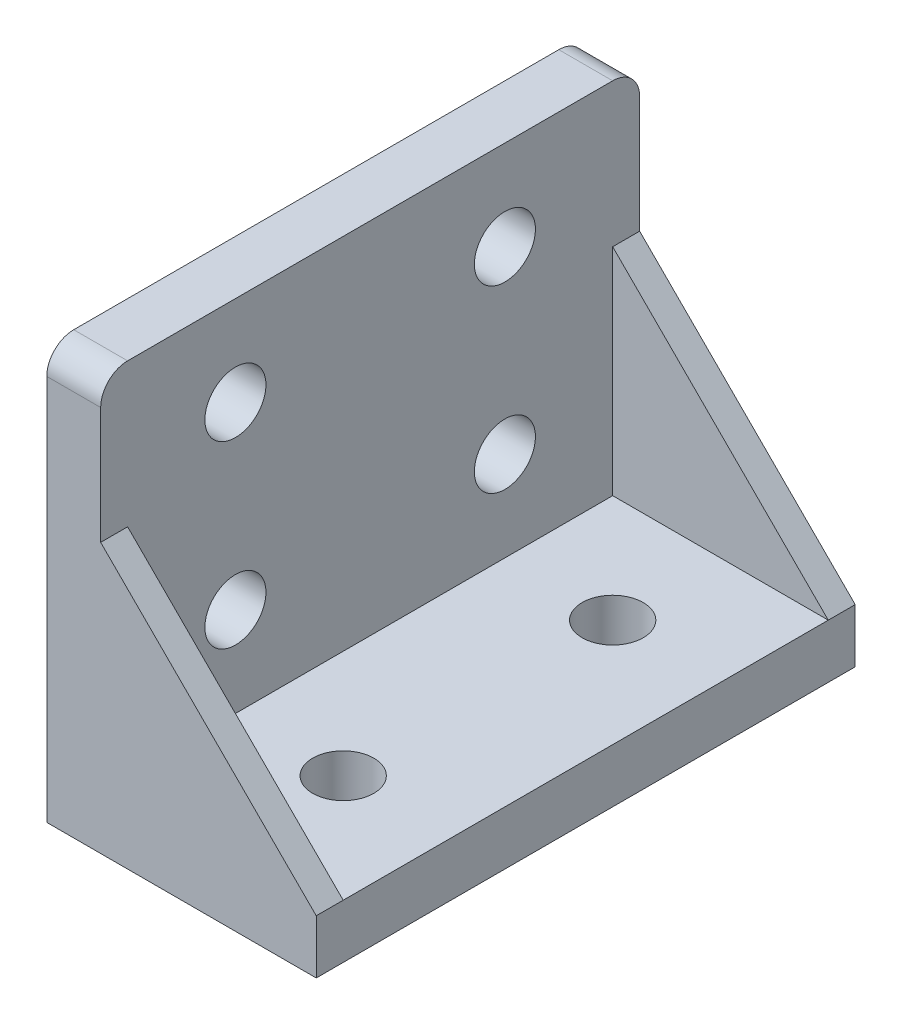
from build123d import *

# Parameters (mm, degrees)
PROFILE_EXTRUDE_DEPTH     = 30
GUSSET_1_EXTRUDE_DEPTH    = 1.5
GUSSET_START              = 28.5
GUSSET_2_EXTRUDE_DEPTH    = 1.5
SOLENOID_MOUNTING_HOLES_D = 3.4
M3_MOUNTING_HOLES_D       = 3.4
CORNER_FILLETS_R          = 1.5


with BuildPart() as part:
    # Profile Sketch → Profile  Extrude (new body)
    with BuildSketch(Plane.XY):
        Polygon((0, 0), (0, 20), (-3, 20), (-3, -3), (12, -3), (12, 0), align=None)
    extrude(amount=PROFILE_EXTRUDE_DEPTH)

    # Gusset Sketch → Gusset 1 Extrude (add)
    with BuildSketch(Plane.XY):
        Polygon((0, 0), (12, 0), (0, 12), align=None)
    extrude(amount=GUSSET_1_EXTRUDE_DEPTH)

    # Gusset Sketch<2> → Gusset 2 Extrude (add)
    with BuildSketch(Plane.XY.offset(GUSSET_START)):
        Polygon((0, 0), (12, 0), (0, 12), align=None)
    extrude(amount=GUSSET_2_EXTRUDE_DEPTH)

    # Solenoid Mounting Holes (through all)
    with Locations(Plane(origin=(0, 0, 0), x_dir=(0, 0, -1), z_dir=(1, 0, 0))):
        with Locations((-7.5, 15), (-22.5, 15), (-22.5, 5), (-7.5, 5)):
            Hole(SOLENOID_MOUNTING_HOLES_D / 2)

    # M3 Mounting Holes (through all)
    with Locations(Plane(origin=(0, 0, 0), x_dir=(1, 0, 0), z_dir=(0, 1, 0))):
        with Locations((6, -22.5), (6, -7.5)):
            Hole(M3_MOUNTING_HOLES_D / 2)

    # Corner Fillets
    corner_fillets_edges = [part.edges().sort_by_distance(p)[0] for p in [
        (-1.5, 20, 30),
        (-1.5, 20, 0),
    ]]
    fillet(corner_fillets_edges, radius=CORNER_FILLETS_R)


solid = part.part
